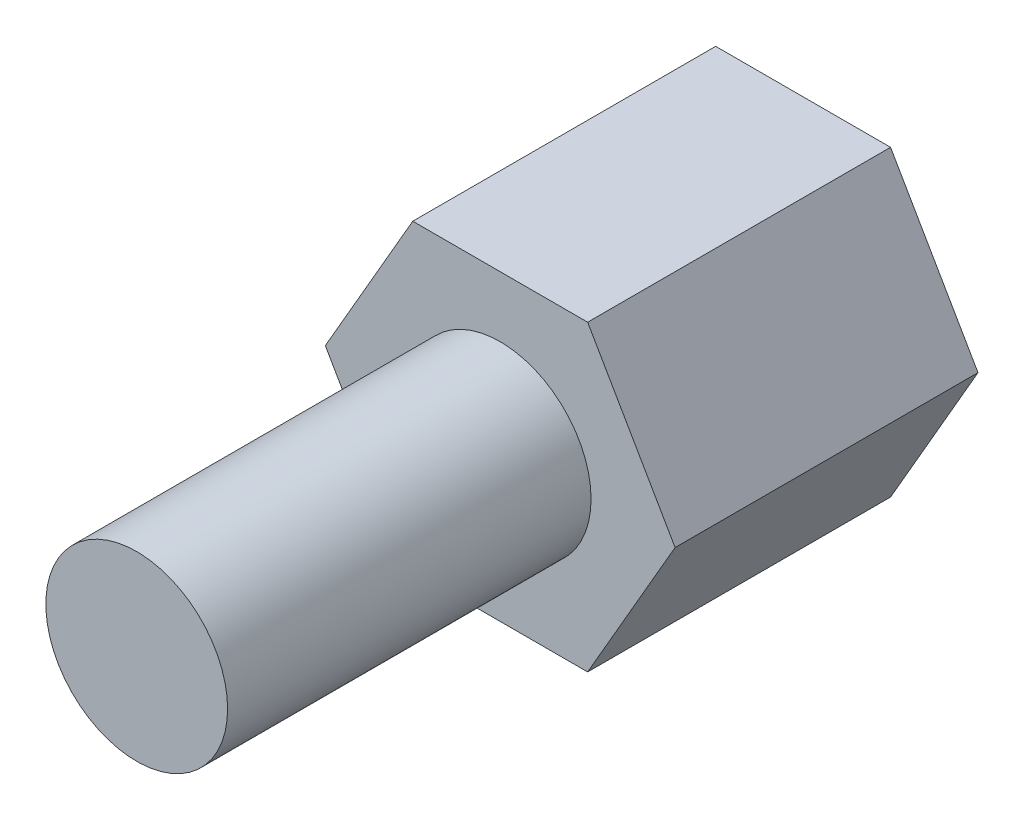
from build123d import *

# Parameters (mm, degrees)
EXTRUDE_1_DEPTH = 5
SKETCH_2_R      = 1.5
EXTRUDE_2_DEPTH = 6
M3X0_5_1_D      = 2.5
M3X0_5_1_DEPTH  = 6.5
M3X0_5_1_TIP    = 0.751075774


with BuildPart() as part:
    # 草图1 → 拉伸1 (new body)
    with BuildSketch(Plane.XY):
        Polygon((1.443375673, -2.5), (2.886751346, 0), (1.443375673, 2.5), (-1.443375673, 2.5), (-2.886751346, 0), (-1.443375673, -2.5), align=None)
    extrude(amount=EXTRUDE_1_DEPTH)

    # 草图2 → 拉伸2 (add)
    with BuildSketch(Plane.XY.offset(5)):
        Circle(SKETCH_2_R)
    extrude(amount=EXTRUDE_2_DEPTH)

    # M3x0.5 螺纹孔1
    with Locations(Plane(origin=(0, 0, 0), x_dir=(-1, 0, 0), z_dir=(0, 0, -1))):
        with Locations((0, 0)):
            Hole(M3X0_5_1_D / 2, depth=M3X0_5_1_DEPTH)
            with Locations((0, 0, -(M3X0_5_1_DEPTH + M3X0_5_1_TIP / 2))):  # 118° drill point
                Cone(0, M3X0_5_1_D / 2, M3X0_5_1_TIP, mode=Mode.SUBTRACT)


solid = part.part
